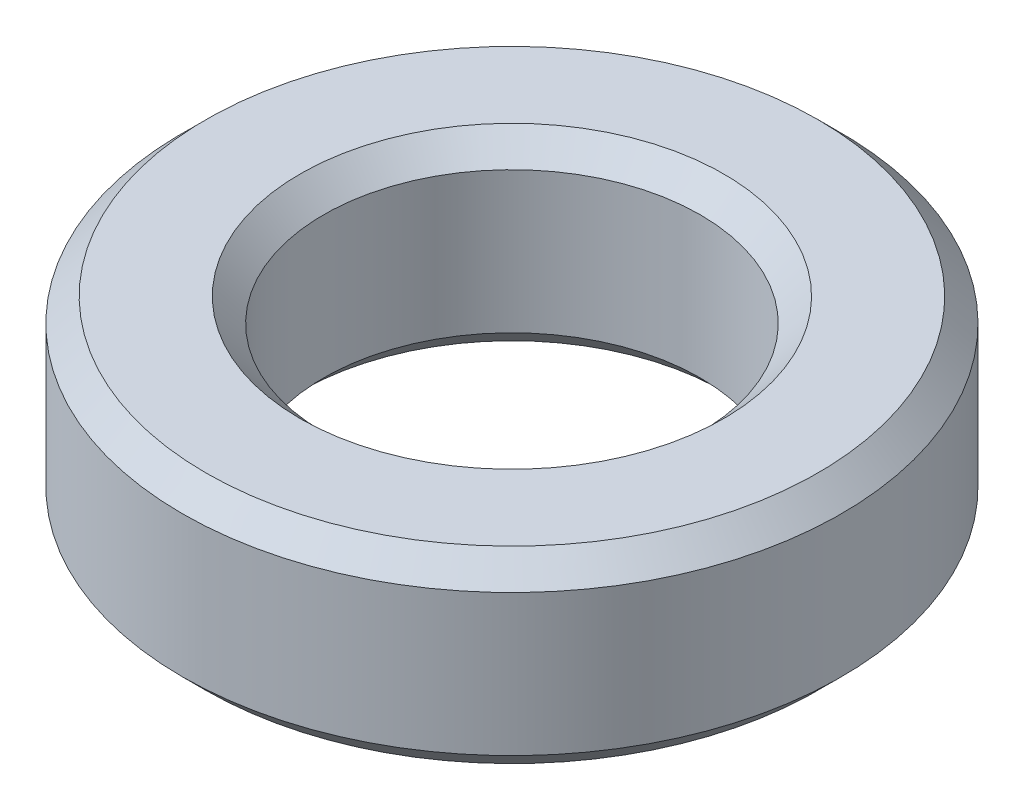
from build123d import *

# Parameters (mm, degrees)
SKETCH1_R           = 7
SKETCH1_R_2         = 4
BOSS_EXTRUDE1_DEPTH = 4
CHAMFER1_SIZE       = 0.5


with BuildPart() as part:
    # Sketch1 → Boss-Extrude1 (new body)
    with BuildSketch(Plane(origin=(0, 0, 0), x_dir=(1, 0, 0), z_dir=(0, 1, 0))):
        with Locations(Location((0, 0, 0), (0, 0, 270))):
            Circle(SKETCH1_R)
        with Locations(Location((0, 0, 0), (0, 0, 270))):
            Circle(SKETCH1_R_2, mode=Mode.SUBTRACT)
    extrude(amount=BOSS_EXTRUDE1_DEPTH)

    # Chamfer1
    chamfer1_edges = [part.edges().sort_by_distance(p)[0] for p in [
        (0, 0, -7),
        (0, 4, -7),
        (0, 0, -4),
        (0, 4, -4),
    ]]
    chamfer(chamfer1_edges, length=CHAMFER1_SIZE)


solid = part.part
